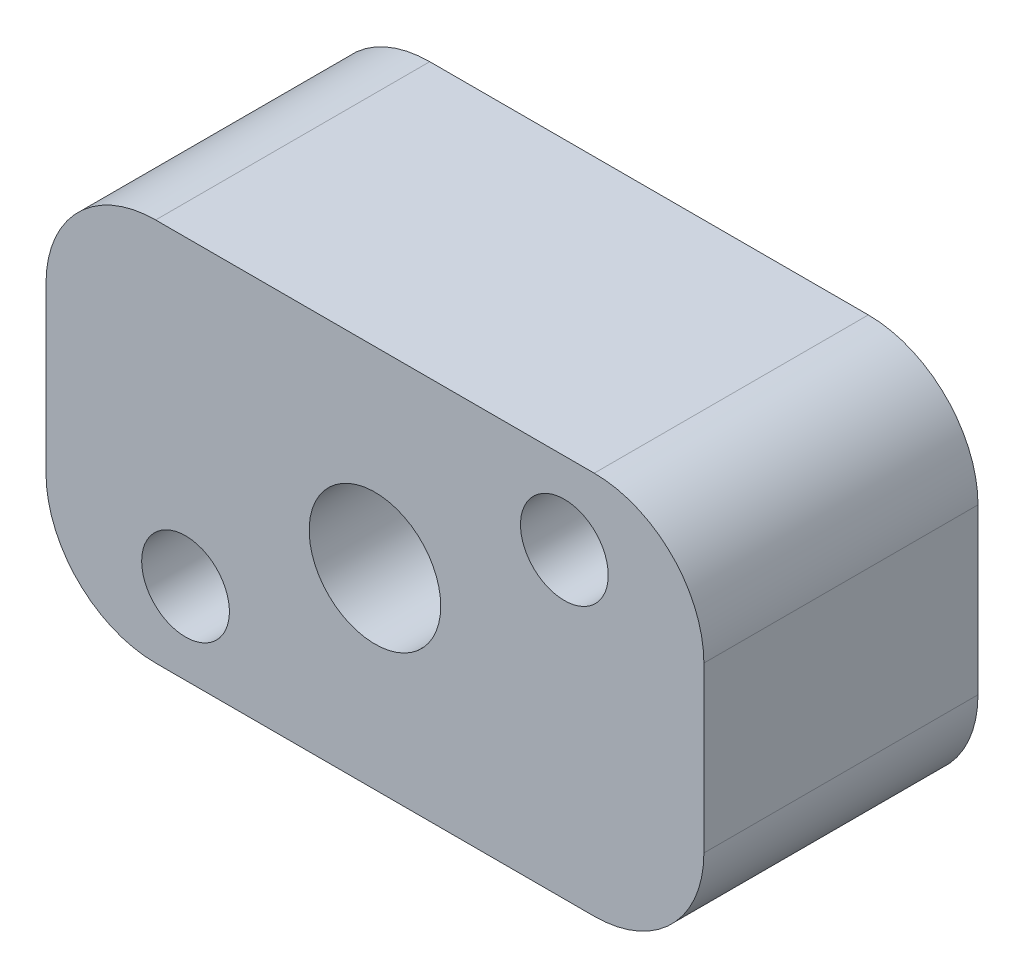
from build123d import *

# Parameters (mm, degrees)
ESQUISSE1_W        = 60
ESQUISSE1_H        = 35
ESQUISSE1_R        = 6
ESQUISSE1_R_2      = 4
BOSS_EXTRU_1_DEPTH = 25
CONG_1_R           = 10


with BuildPart() as part:
    # Esquisse1 → Boss.-Extru.1 (new body)
    with BuildSketch(Plane.XY):
        with Locations((30, 17.5)):
            Rectangle(ESQUISSE1_W, ESQUISSE1_H)
        with Locations((30, 17.5)):
            Circle(ESQUISSE1_R, mode=Mode.SUBTRACT)
        with Locations((47.275578018, 27.57742051)):
            Circle(ESQUISSE1_R_2, mode=Mode.SUBTRACT)
        with Locations(Location((12.724421982, 7.42257949, 0), (0, 0, 180))):
            Circle(ESQUISSE1_R_2, mode=Mode.SUBTRACT)
    extrude(amount=BOSS_EXTRU_1_DEPTH)

    # Congé1
    cong_1_edges = [part.edges().sort_by_distance(p)[0] for p in [
        (0, 35, 12.5),
        (60, 35, 12.5),
        (60, 0, 12.5),
        (0, 0, 12.5),
    ]]
    fillet(cong_1_edges, radius=CONG_1_R)


solid = part.part
